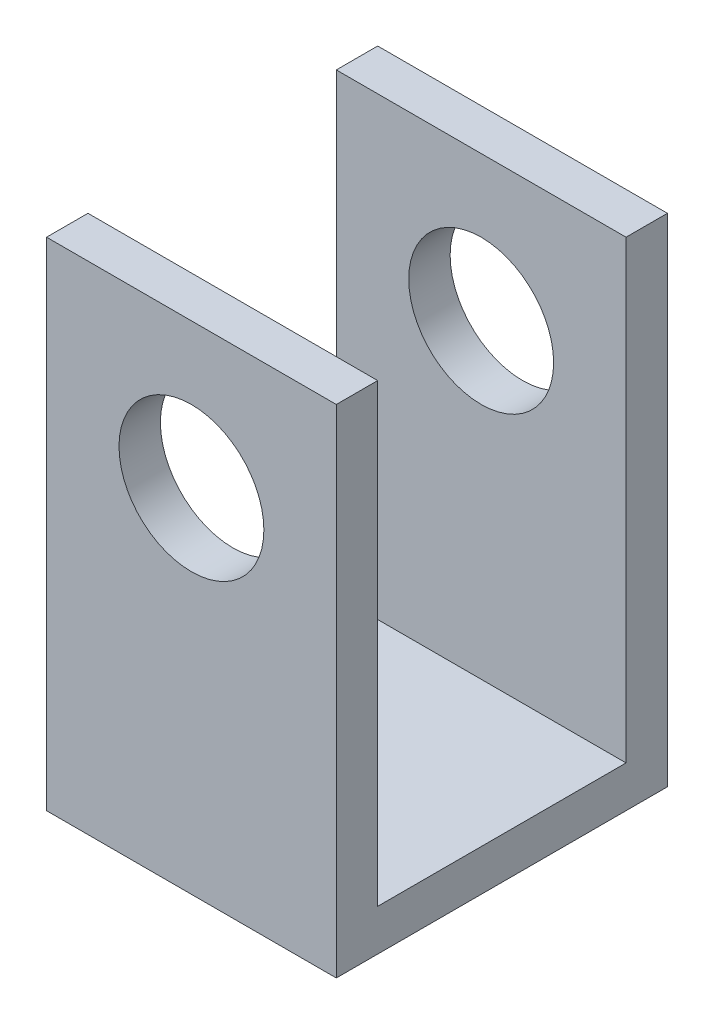
from build123d import *

# Parameters (mm, degrees)
SKETCH1_W           = 70
SKETCH1_H           = 120
SKETCH1_R           = 17.5
BOSS_EXTRUDE3_DEPTH = 80
SKETCH2_W           = 70
SKETCH2_H           = 60
CUT_EXTRUDE1_DEPTH  = 110


with BuildPart() as part:
    # Sketch1 → Boss-Extrude3 (new body)
    with BuildSketch(Plane.XY):
        with Locations((35, 60)):
            Rectangle(SKETCH1_W, SKETCH1_H)
        with Locations((35, 85)):
            Circle(SKETCH1_R, mode=Mode.SUBTRACT)
    extrude(amount=BOSS_EXTRUDE3_DEPTH)

    # Sketch2 → Cut-Extrude1 (cut)
    with BuildSketch(Plane(origin=(0, 120, 0), x_dir=(1, 0, 0), z_dir=(0, 1, 0))):
        with Locations((35, -40)):
            Rectangle(SKETCH2_W, SKETCH2_H)
    extrude(amount=-CUT_EXTRUDE1_DEPTH, mode=Mode.SUBTRACT)


solid = part.part
